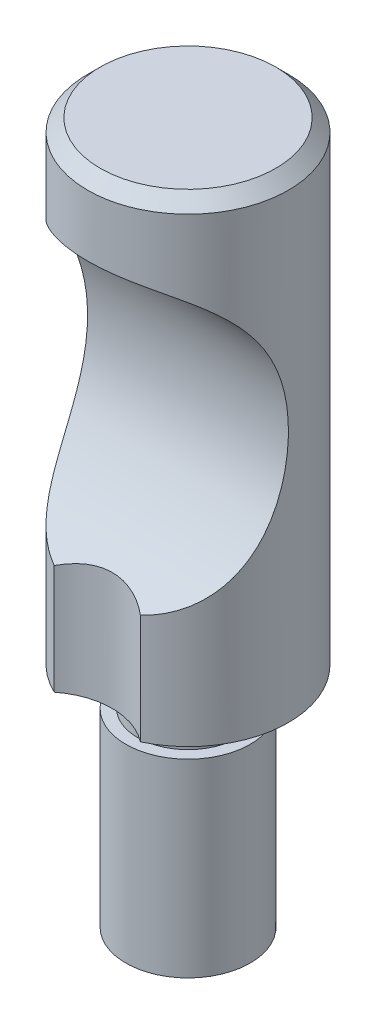
from build123d import *

# Parameters (mm, degrees)
CUT_EXTRUDE1_REACH             = 58.627
SKETCH2_R                      = 12.5
CUT_EXTRUDE1_DIRECTION_2_REACH = 58.627
CUT_EXTRUDE2_REACH             = 41.149
CUT_EXTRUDE2_END_RADIUS        = 12.5
SKETCH3_R                      = 5.5
CHAMFER1_SIZE                  = 1


with BuildPart() as part:
    # Sketch1 → Revolve1 (revolve)
    with BuildSketch(Plane.XY, mode=Mode.PRIVATE) as revolve1_sk:
        Polygon((0, 55.5), (7.95, 55.5), (7.95, 18), (4, 18), (4, 15), (4.925, 15), (4.925, 0), (0, 0), align=None)
    revolve(revolve1_sk.sketch.rotate(Axis((0, 0, 0), (0, 1, 0)), 90), axis=Axis((0, 0, 0), (0, 1, 0)))

    # Sketch2 → Cut-Extrude1 (cut, up to next)
    with BuildSketch(Plane(origin=(0, 0, 0), x_dir=(0, 0, -1), z_dir=(1, 0, 0)), mode=Mode.PRIVATE) as cut_extrude1_sk1:
        with Locations((-12.5, 38)):
            Circle(SKETCH2_R)
    cut_extrude1_tool1 = extrude(cut_extrude1_sk1.sketch, amount=-CUT_EXTRUDE1_REACH, mode=Mode.PRIVATE) & part.part
    add(cut_extrude1_tool1.solids().sort_by_distance((0, 38, 12.5))[0], mode=Mode.SUBTRACT)

    # Sketch2 → Cut-Extrude1 direction 2 (cut, up to next)
    with BuildSketch(Plane(origin=(0, 0, 0), x_dir=(0, 0, -1), z_dir=(1, 0, 0)), mode=Mode.PRIVATE) as cut_extrude1_direction_2_sk1:
        with Locations((-12.5, 38)):
            Circle(SKETCH2_R)
    cut_extrude1_direction_2_tool1 = extrude(cut_extrude1_direction_2_sk1.sketch, amount=CUT_EXTRUDE1_DIRECTION_2_REACH, mode=Mode.PRIVATE) & part.part
    add(cut_extrude1_direction_2_tool1.solids().sort_by_distance((0, 38, 12.5))[0], mode=Mode.SUBTRACT)

    # Cut-Extrude2: up to this cylinder (the profile starts outside it)
    cut_extrude2_end = Plane(origin=(0, 38, 12.5), z_dir=(-1, 0, 0)) * Cylinder(CUT_EXTRUDE2_END_RADIUS, 108.298, mode=Mode.PRIVATE)
    # Sketch3 → Cut-Extrude2 (cut, up to the surface)
    with BuildSketch(Plane.XZ.offset(-18), mode=Mode.PRIVATE) as cut_extrude2_sk1:
        with Locations((0, 11.5)):
            Circle(SKETCH3_R)
    cut_extrude2_tool1 = extrude(cut_extrude2_sk1.sketch, amount=-CUT_EXTRUDE2_REACH, mode=Mode.PRIVATE) - cut_extrude2_end
    add(cut_extrude2_tool1.solids().sort_by_distance((0, 18, 11.5))[0], mode=Mode.SUBTRACT)

    # Chamfer1
    chamfer1_edges = [part.edges().sort_by_distance(p)[0] for p in [
        (0, 55.5, 7.95),
    ]]
    chamfer(chamfer1_edges, length=CHAMFER1_SIZE)


solid = part.part
